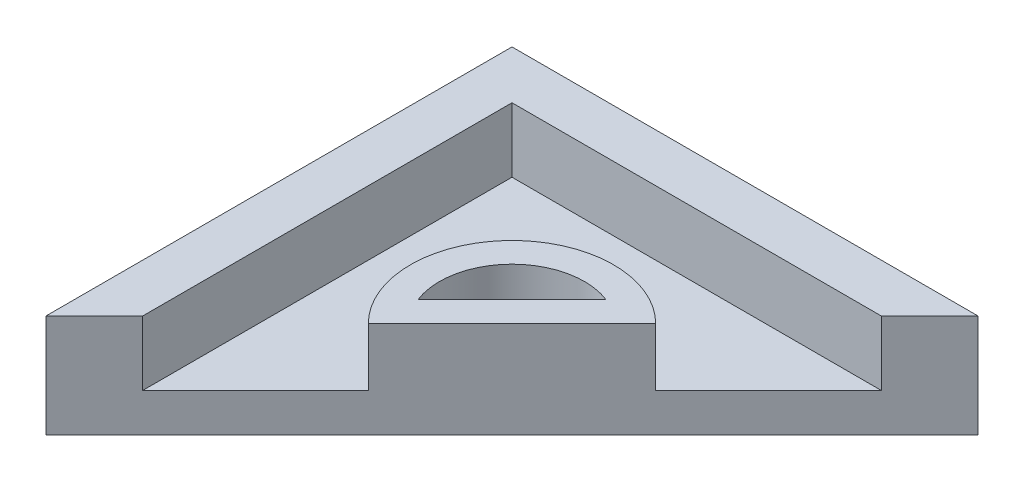
from build123d import *

# Parameters (mm, degrees)
BOSS_EXTRUDE1_DEPTH = 1.2
BOSS_EXTRUDE2_DEPTH = 2
BOSS_EXTRUDE3_DEPTH = 1.8


with BuildPart() as part:
    # Sketch1 → Boss-Extrude1 (new body)
    with BuildSketch(Plane(origin=(0, 0, 0), x_dir=(1, 0, 0), z_dir=(0, 1, 0))):
        Polygon((0, 0), (14.45, 0), (0, -14.45), align=None)
    extrude(amount=-BOSS_EXTRUDE1_DEPTH)

    # Sketch2 → Boss-Extrude2 (add)
    with BuildSketch(Plane(origin=(0, 0, 0), x_dir=(1, 0, 0), z_dir=(0, 1, 0))):
        Polygon((0, 0), (14.45, 0), (12.95, -1.5), (1.5, -1.5), (1.5, -12.95), (0, -14.45), align=None)
    extrude(amount=BOSS_EXTRUDE2_DEPTH)

    # Sketch3 → Boss-Extrude3 (add)
    with BuildSketch(Plane(origin=(0, 0, 0), x_dir=(1, 0, 0), z_dir=(0, 1, 0))):
        with BuildLine():
            Line((4.997613639, -9.452386361), (9.452386361, -4.997613639))
            ThreePointArc((9.452386361, -4.997613639), (4.997613639, -4.997613639), (4.997613639, -9.452386361))
        make_face()
        with BuildLine():
            Line((5.13043724, -8.046770554), (8.046770554, -5.13043724))
            ThreePointArc((8.046770554, -5.13043724), (5.634009742, -5.634009742), (5.13043724, -8.046770554))
        make_face(mode=Mode.SUBTRACT)
    extrude(amount=BOSS_EXTRUDE3_DEPTH)


solid = part.part
